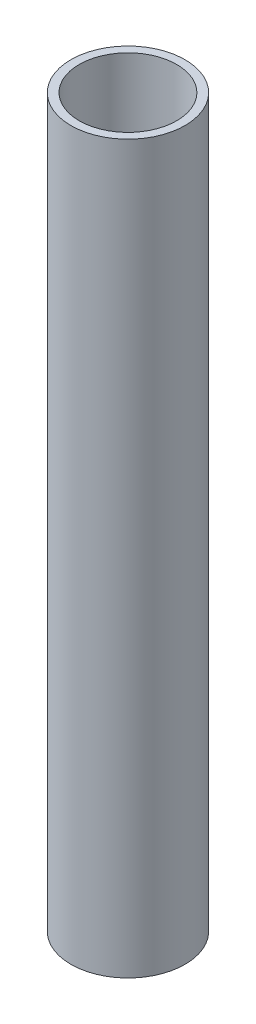
from build123d import *

# Parameters (mm, degrees)
SKETCH1_R           = 27.5
SKETCH1_R_2         = 23.5
BOSS_EXTRUDE1_DEPTH = 175


with BuildPart() as part:
    # Sketch1 → Boss-Extrude1 (new, symmetric)
    with BuildSketch(Plane(origin=(0, 0, 0), x_dir=(1, 0, 0), z_dir=(0, 1, 0))):
        with Locations(Location((0, 0, 0), (0, 0, 270))):
            Circle(SKETCH1_R)
        with Locations(Location((0, 0, 0), (0, 0, 270))):
            Circle(SKETCH1_R_2, mode=Mode.SUBTRACT)
    extrude(amount=BOSS_EXTRUDE1_DEPTH, both=True)


solid = part.part
